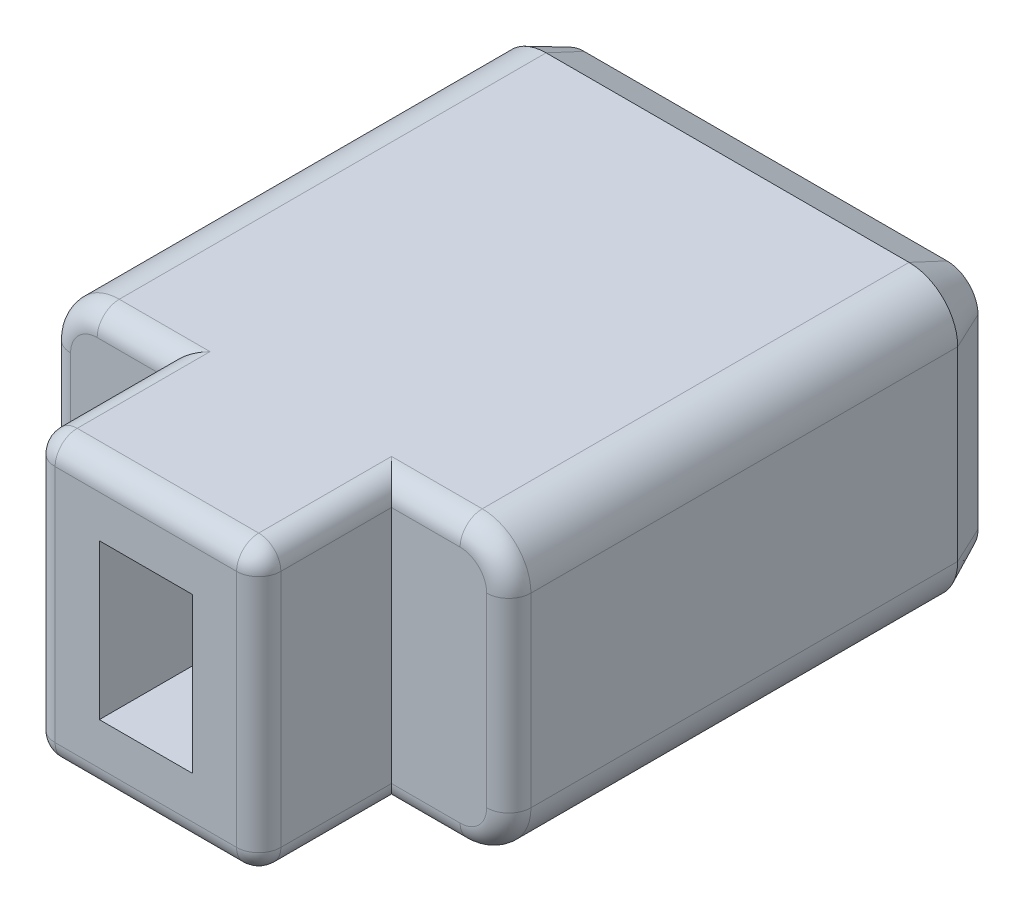
from build123d import *

# Parameters (mm, degrees)
BOSS_EXTRU_1_DEPTH      = 14
ESQUISSE3_W             = 2.1
ESQUISSE3_H             = 3.5
ENL_V_MAT_EXTRU_1_DEPTH = 3
ESQUISSE4_OUTSIDE_W     = 16.116
ESQUISSE4_OUTSIDE_H     = 12.116
ESQUISSE4_OUTSIDE_W_2   = 5.1
ESQUISSE4_OUTSIDE_H_2   = 6.4
ENL_V_MAT_EXTRU_2_DEPTH = 3
CONG_1_R                = 0.5
CHANFREIN1_SIZE         = 0.4
CHANFREIN1_SIZE2        = 0.857802768
ENL_V_MAT_EXTRU_3_DEPTH = 0.3
BOSS_EXTRU_2_DEPTH      = 0.3


with BuildPart() as part:
    # Esquisse2 → Boss.-Extru.1 (new body)
    with BuildSketch(Plane.XY):
        with BuildLine():
            Line((1.1, 0), (9.3, 0))
            ThreePointArc((9.3, 0), (10.077817459, 0.322182541), (10.4, 1.1))
            Line((10.4, 1.1), (10.4, 5.3))
            ThreePointArc((10.4, 5.3), (10.077817459, 6.077817459), (9.3, 6.4))
            Line((9.3, 6.4), (1.1, 6.4))
            ThreePointArc((1.1, 6.4), (0.322182541, 6.077817459), (0, 5.3))
            Line((0, 5.3), (0, 1.1))
            ThreePointArc((0, 1.1), (0.322182541, 0.322182541), (1.1, 0))
        make_face()
    extrude(amount=BOSS_EXTRU_1_DEPTH)

    # Esquisse3 → Enlèv. mat.-Extru.1 (cut)
    with BuildSketch(Plane.XY.offset(14)):
        with Locations((5.2, 3.2)):
            Rectangle(ESQUISSE3_W, ESQUISSE3_H)
    extrude(amount=-ENL_V_MAT_EXTRU_1_DEPTH, mode=Mode.SUBTRACT)

    # Esquisse4 outside → Enlèv. mat.-Extru.2 (cut)
    with BuildSketch(Plane.XY.offset(14)):
        with Locations((5.2, 3.2)):
            Rectangle(ESQUISSE4_OUTSIDE_W, ESQUISSE4_OUTSIDE_H)
        with Locations((5.2, 3.2)):
            Rectangle(ESQUISSE4_OUTSIDE_W_2, ESQUISSE4_OUTSIDE_H_2, mode=Mode.SUBTRACT)
    extrude(amount=-ENL_V_MAT_EXTRU_2_DEPTH, mode=Mode.SUBTRACT)

    # Congé1
    cong_1_edges = [part.edges().sort_by_distance(p)[0] for p in [
        (8.525, 0, 11),
        (10.077817459, 0.322182541, 11),
        (10.4, 3.2, 11),
        (10.077817459, 6.077817459, 11),
        (1.875, 6.4, 11),
        (0.322182541, 6.077817459, 11),
        (1.875, 0, 11),
        (0.322182541, 0.322182541, 11),
        (7.75, 6.4, 12.5),
        (2.65, 6.4, 12.5),
        (7.75, 0, 12.5),
        (2.65, 0, 12.5),
        (2.65, 3.2, 14),
        (5.2, 6.4, 14),
        (7.75, 3.2, 14),
        (5.2, 0, 14),
        (8.525, 6.4, 11),
        (0, 3.2, 11),
    ]]
    fillet(cong_1_edges, radius=CONG_1_R)

    # Chanfrein1
    chanfrein1_edges = [part.edges().sort_by_distance(p)[0] for p in [
        (5.2, 0, 0),
        (10.077817459, 0.322182541, 0),
        (0.322182541, 0.322182541, 0),
        (10.4, 3.2, 0),
        (0, 3.2, 0),
        (10.077817459, 6.077817459, 0),
        (0.322182541, 6.077817459, 0),
        (5.2, 6.4, 0),
    ]]
    chanfrein1_side = [part.faces().sort_by_distance(p)[0] for p in [
        (5.2, 3.2, 0),
    ]]
    chamfer(chanfrein1_edges, length=CHANFREIN1_SIZE, length2=CHANFREIN1_SIZE2, reference=chanfrein1_side[0])

    # Esquisse5 → Enlèv. mat.-Extru.3 (cut)
    with BuildSketch(Plane(origin=(0, 0, 0), x_dir=(-1, 0, 0), z_dir=(0, 0, -1))):
        with BuildLine():
            Line((-4.482051282, 2.530769231), (-4.123076923, 2.530769231))
            add(Edge.make_bspline(
                [(-4.123076923, 2.530769231), (-4.125288791, 2.483167835), (-4.129628304, 2.38977759), (-4.148345226, 2.253406764), (-4.17627157, 2.123340974), (-4.214430497, 1.999774332), (-4.264003017, 1.882875843), (-4.322214341, 1.772104955), (-4.390812153, 1.667880652), (-4.469114009, 1.571707448), (-4.554057931, 1.483919975), (-4.644999905, 1.40685226), (-4.741707449, 1.342960833), (-4.842452966, 1.288958809), (-4.948745531, 1.248523316), (-5.059476378, 1.218360764), (-5.175371631, 1.20039124), (-5.254424579, 1.198430934), (-5.294551282, 1.197435897)],
                knots=[0, 0, 0, 0, 1.157348951, 2.270628868, 3.339854951, 4.38667075, 5.407537659, 6.420681518, 7.423232439, 8.433712426, 9.429582902, 10.387626108, 11.323566714, 12.240895944, 13.159234641, 14.08016076, 15.025503541, 16, 16, 16, 16], degree=3))
            add(Edge.make_bspline(
                [(-5.294551282, 1.197435897), (-5.334145732, 1.198452907), (-5.411571118, 1.200441629), (-5.524656609, 1.21779834), (-5.631972566, 1.245644285), (-5.733347647, 1.285405213), (-5.829860921, 1.335017556), (-5.919496382, 1.397590144), (-6.004703762, 1.46975275), (-6.081123559, 1.5541066), (-6.151305619, 1.644524098), (-6.212479674, 1.740269139), (-6.264074813, 1.84001067), (-6.305766774, 1.943971528), (-6.338623907, 2.051748411), (-6.363073845, 2.163391861), (-6.376536348, 2.27936847), (-6.378494424, 2.357926884), (-6.379487179, 2.39775641)],
                knots=[0, 0, 0, 0, 1.051711384, 2.056580109, 3.032785785, 3.992411975, 4.944870775, 5.909628692, 6.891264423, 7.905937952, 8.928180638, 9.930438659, 10.920939654, 11.90820525, 12.902894, 13.912265297, 14.941507625, 16, 16, 16, 16], degree=3))
            add(Edge.make_bspline(
                [(-6.379487179, 2.39775641), (-6.377839472, 2.453953141), (-6.374580282, 2.565111134), (-6.347168361, 2.728800384), (-6.303149453, 2.886887627), (-6.250722421, 3.014802725), (-6.198201191, 3.118349126), (-6.149988377, 3.20289044), (-6.093728221, 3.294189286), (-6.029601708, 3.39217379), (-5.956201308, 3.496129892), (-5.875464864, 3.607400157), (-5.786519112, 3.725431188), (-5.723152213, 3.805216599), (-5.690384615, 3.846474359)],
                knots=[0, 0, 0, 0, 1.233535321, 2.439951703, 3.634083941, 4.831223584, 5.468697265, 6.183186553, 6.967907589, 7.823691141, 8.75452848, 9.762411661, 10.842922778, 12, 12, 12, 12], degree=3))
            Line((-5.690384615, 3.846474359), (-4.842628205, 4.88974359))
            Line((-4.842628205, 4.88974359), (-6.430769231, 4.88974359))
            Line((-6.430769231, 4.88974359), (-6.430769231, 5.3))
            Line((-6.430769231, 5.3), (-4.020512821, 5.3))
            Line((-4.020512821, 5.3), (-5.365064103, 3.644551282))
            add(Edge.make_bspline(
                [(-5.365064103, 3.644551282), (-5.397745675, 3.605100528), (-5.460603999, 3.529222652), (-5.549603262, 3.418669742), (-5.629661676, 3.316044094), (-5.701640907, 3.221866579), (-5.762597652, 3.13412526), (-5.817275763, 3.056046675), (-5.861156189, 2.984603177), (-5.908327651, 2.90098471), (-5.953668714, 2.799212438), (-5.992546748, 2.675350358), (-6.015606974, 2.547916595), (-6.018867975, 2.461950804), (-6.020512821, 2.418589744)],
                knots=[0, 0, 0, 0, 1.297618079, 2.495782571, 3.594697613, 4.594628131, 5.497499245, 6.300647139, 7.008465005, 7.620238698, 8.731681699, 9.822989966, 10.90191829, 12, 12, 12, 12], degree=3))
            add(Edge.make_bspline(
                [(-6.020512821, 2.418589744), (-6.019990945, 2.391309583), (-6.018963655, 2.337609776), (-6.00804603, 2.258798363), (-5.991206453, 2.182940499), (-5.968024047, 2.109551218), (-5.93760043, 2.039268902), (-5.900315416, 1.971886744), (-5.855851328, 1.907866735), (-5.806135812, 1.84666214), (-5.751096427, 1.790909038), (-5.692685985, 1.741537482), (-5.630525782, 1.700728345), (-5.565785281, 1.666414234), (-5.497765049, 1.639975215), (-5.426714126, 1.621736358), (-5.352897954, 1.609999916), (-5.30260961, 1.608472493), (-5.276923077, 1.607692308)],
                knots=[0, 0, 0, 0, 1.06989504, 2.106041779, 3.115552866, 4.11659498, 5.121251965, 6.115853611, 7.133385419, 8.176137438, 9.206329872, 10.203413544, 11.171427972, 12.118447235, 13.074126855, 14.027447124, 14.992449553, 16, 16, 16, 16], degree=3))
            add(Edge.make_bspline(
                [(-5.276923077, 1.607692308), (-5.250168937, 1.608481971), (-5.19749153, 1.610036773), (-5.120245041, 1.62174089), (-5.045722505, 1.639561172), (-4.975560355, 1.667546757), (-4.90808558, 1.700823022), (-4.845406646, 1.743589853), (-4.784895696, 1.79215878), (-4.728916056, 1.849323749), (-4.677902675, 1.913376499), (-4.631812933, 1.98354724), (-4.591996629, 2.059930043), (-4.557203996, 2.142033118), (-4.529156456, 2.23058454), (-4.508316805, 2.325391202), (-4.490631794, 2.425822556), (-4.48496141, 2.495175992), (-4.482051282, 2.530769231)],
                knots=[0, 0, 0, 0, 0.947461108, 1.865498056, 2.762867956, 3.655585777, 4.535828722, 5.422911659, 6.337724158, 7.281207503, 8.250670221, 9.234891363, 10.250764949, 11.298232114, 12.39055947, 13.53602619, 14.735451151, 16, 16, 16, 16], degree=3))
        make_face()
    extrude(amount=-ENL_V_MAT_EXTRU_3_DEPTH, mode=Mode.SUBTRACT)


with BuildPart() as body_2:
    # Esquisse5<2> → Boss.-Extru.2 (new body)
    with BuildSketch(Plane(origin=(0, 0, 0), x_dir=(-1, 0, 0), z_dir=(0, 0, -1))):
        with BuildLine():
            Line((-4.482051282, 2.530769231), (-4.123076923, 2.530769231))
            add(Edge.make_bspline(
                [(-4.123076923, 2.530769231), (-4.125288791, 2.483167835), (-4.129628304, 2.38977759), (-4.148345226, 2.253406764), (-4.17627157, 2.123340974), (-4.214430497, 1.999774332), (-4.264003017, 1.882875843), (-4.322214341, 1.772104955), (-4.390812153, 1.667880652), (-4.469114009, 1.571707448), (-4.554057931, 1.483919975), (-4.644999905, 1.40685226), (-4.741707449, 1.342960833), (-4.842452966, 1.288958809), (-4.948745531, 1.248523316), (-5.059476378, 1.218360764), (-5.175371631, 1.20039124), (-5.254424579, 1.198430934), (-5.294551282, 1.197435897)],
                knots=[0, 0, 0, 0, 1.157348951, 2.270628868, 3.339854951, 4.38667075, 5.407537659, 6.420681518, 7.423232439, 8.433712426, 9.429582902, 10.387626108, 11.323566714, 12.240895944, 13.159234641, 14.08016076, 15.025503541, 16, 16, 16, 16], degree=3))
            add(Edge.make_bspline(
                [(-5.294551282, 1.197435897), (-5.334145732, 1.198452907), (-5.411571118, 1.200441629), (-5.524656609, 1.21779834), (-5.631972566, 1.245644285), (-5.733347647, 1.285405213), (-5.829860921, 1.335017556), (-5.919496382, 1.397590144), (-6.004703762, 1.46975275), (-6.081123559, 1.5541066), (-6.151305619, 1.644524098), (-6.212479674, 1.740269139), (-6.264074813, 1.84001067), (-6.305766774, 1.943971528), (-6.338623907, 2.051748411), (-6.363073845, 2.163391861), (-6.376536348, 2.27936847), (-6.378494424, 2.357926884), (-6.379487179, 2.39775641)],
                knots=[0, 0, 0, 0, 1.051711384, 2.056580109, 3.032785785, 3.992411975, 4.944870775, 5.909628692, 6.891264423, 7.905937952, 8.928180638, 9.930438659, 10.920939654, 11.90820525, 12.902894, 13.912265297, 14.941507625, 16, 16, 16, 16], degree=3))
            add(Edge.make_bspline(
                [(-6.379487179, 2.39775641), (-6.377839472, 2.453953141), (-6.374580282, 2.565111134), (-6.347168361, 2.728800384), (-6.303149453, 2.886887627), (-6.250722421, 3.014802725), (-6.198201191, 3.118349126), (-6.149988377, 3.20289044), (-6.093728221, 3.294189286), (-6.029601708, 3.39217379), (-5.956201308, 3.496129892), (-5.875464864, 3.607400157), (-5.786519112, 3.725431188), (-5.723152213, 3.805216599), (-5.690384615, 3.846474359)],
                knots=[0, 0, 0, 0, 1.233535321, 2.439951703, 3.634083941, 4.831223584, 5.468697265, 6.183186553, 6.967907589, 7.823691141, 8.75452848, 9.762411661, 10.842922778, 12, 12, 12, 12], degree=3))
            Line((-5.690384615, 3.846474359), (-4.842628205, 4.88974359))
            Line((-4.842628205, 4.88974359), (-6.430769231, 4.88974359))
            Line((-6.430769231, 4.88974359), (-6.430769231, 5.3))
            Line((-6.430769231, 5.3), (-4.020512821, 5.3))
            Line((-4.020512821, 5.3), (-5.365064103, 3.644551282))
            add(Edge.make_bspline(
                [(-5.365064103, 3.644551282), (-5.397745675, 3.605100528), (-5.460603999, 3.529222652), (-5.549603262, 3.418669742), (-5.629661676, 3.316044094), (-5.701640907, 3.221866579), (-5.762597652, 3.13412526), (-5.817275763, 3.056046675), (-5.861156189, 2.984603177), (-5.908327651, 2.90098471), (-5.953668714, 2.799212438), (-5.992546748, 2.675350358), (-6.015606974, 2.547916595), (-6.018867975, 2.461950804), (-6.020512821, 2.418589744)],
                knots=[0, 0, 0, 0, 1.297618079, 2.495782571, 3.594697613, 4.594628131, 5.497499245, 6.300647139, 7.008465005, 7.620238698, 8.731681699, 9.822989966, 10.90191829, 12, 12, 12, 12], degree=3))
            add(Edge.make_bspline(
                [(-6.020512821, 2.418589744), (-6.019990945, 2.391309583), (-6.018963655, 2.337609776), (-6.00804603, 2.258798363), (-5.991206453, 2.182940499), (-5.968024047, 2.109551218), (-5.93760043, 2.039268902), (-5.900315416, 1.971886744), (-5.855851328, 1.907866735), (-5.806135812, 1.84666214), (-5.751096427, 1.790909038), (-5.692685985, 1.741537482), (-5.630525782, 1.700728345), (-5.565785281, 1.666414234), (-5.497765049, 1.639975215), (-5.426714126, 1.621736358), (-5.352897954, 1.609999916), (-5.30260961, 1.608472493), (-5.276923077, 1.607692308)],
                knots=[0, 0, 0, 0, 1.06989504, 2.106041779, 3.115552866, 4.11659498, 5.121251965, 6.115853611, 7.133385419, 8.176137438, 9.206329872, 10.203413544, 11.171427972, 12.118447235, 13.074126855, 14.027447124, 14.992449553, 16, 16, 16, 16], degree=3))
            add(Edge.make_bspline(
                [(-5.276923077, 1.607692308), (-5.250168937, 1.608481971), (-5.19749153, 1.610036773), (-5.120245041, 1.62174089), (-5.045722505, 1.639561172), (-4.975560355, 1.667546757), (-4.90808558, 1.700823022), (-4.845406646, 1.743589853), (-4.784895696, 1.79215878), (-4.728916056, 1.849323749), (-4.677902675, 1.913376499), (-4.631812933, 1.98354724), (-4.591996629, 2.059930043), (-4.557203996, 2.142033118), (-4.529156456, 2.23058454), (-4.508316805, 2.325391202), (-4.490631794, 2.425822556), (-4.48496141, 2.495175992), (-4.482051282, 2.530769231)],
                knots=[0, 0, 0, 0, 0.947461108, 1.865498056, 2.762867956, 3.655585777, 4.535828722, 5.422911659, 6.337724158, 7.281207503, 8.250670221, 9.234891363, 10.250764949, 11.298232114, 12.39055947, 13.53602619, 14.735451151, 16, 16, 16, 16], degree=3))
        make_face()
    extrude(amount=BOSS_EXTRU_2_DEPTH)


solid = Compound([part.part, body_2.part])
